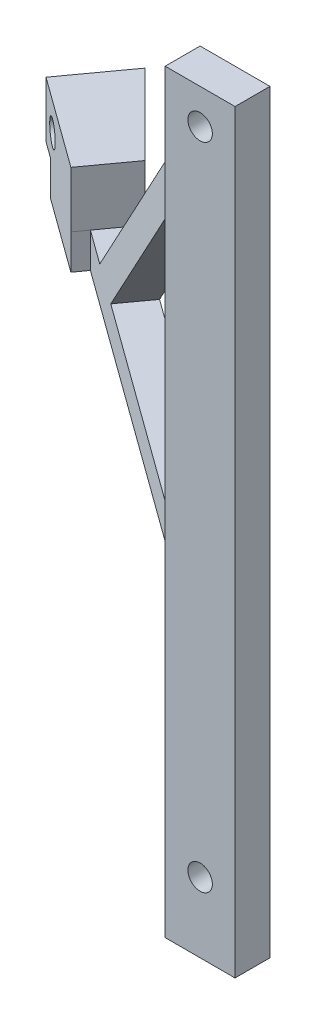
from build123d import *

# Parameters (mm, degrees)
SKETCH1_W           = 10
SKETCH1_H           = 108
BOSS_EXTRUDE1_DEPTH = 5
SKETCH2_R           = 1.75
CUT_EXTRUDE1_DEPTH  = 109.231233939
BOSS_EXTRUDE2_DEPTH = 5
SKETCH5_R           = 2.2
CUT_EXTRUDE2_DEPTH  = 5
BOSS_EXTRUDE3_REACH = 128.484
BOSS_EXTRUDE4_DEPTH = 8
SKETCH8_R           = 1.75
CUT_EXTRUDE3_DEPTH  = 129.116541509


with BuildPart() as part:
    # Sketch1 → Boss-Extrude1 (new body)
    with BuildSketch(Plane.XY):
        with Locations((0, 54)):
            Rectangle(SKETCH1_W, SKETCH1_H)
    extrude(amount=BOSS_EXTRUDE1_DEPTH)

    # Sketch2 → Cut-Extrude1 (cut, through all)
    with BuildSketch(Plane.XY.offset(5)):
        with Locations((0, 10)):
            Circle(SKETCH2_R)
        with Locations((0, 103)):
            Circle(SKETCH2_R)
    extrude(amount=-CUT_EXTRUDE1_DEPTH, mode=Mode.SUBTRACT)

    # Sketch4 → Boss-Extrude2 (add)
    with BuildSketch(Plane(origin=(0, 49.1, 0), x_dir=(-1, 0, 0), z_dir=(0, -1, 0))):
        Polygon((3.377813163, 0), (40.9972684, 27.282007374), (40.703728886, 27.686772187), (51.227614019, 35.318799552), (55.63070673, 29.247327359), (45.106791947, 21.615278492), (43.932633891, 23.234337744), (5, -5), align=None)
    extrude(amount=-BOSS_EXTRUDE2_DEPTH)

    # Sketch5 → Cut-Extrude2 (cut)
    with BuildSketch(Plane.XZ.offset(-49.1)):
        with Locations((-47.97, -29.25)):
            Circle(SKETCH5_R)
    extrude(amount=-CUT_EXTRUDE2_DEPTH, mode=Mode.SUBTRACT)

    # Boss-Extrude3: up to this face of the body (flat: up to its plane)
    boss_extrude3_end = Plane(part.part.faces().sort_by_distance((-22.187540781, 51.6, -13.641003687))[0])
    # Sketch6 → Boss-Extrude3 (add, up to the picked face)
    with BuildSketch(Plane(origin=(-4.099598255, 0, 5.652980403), x_dir=(0.8095296256563876, 0, 0.5870790280572362), z_dir=(-0.5870790280572362, 0, 0.8095296256563876)), mode=Mode.PRIVATE) as boss_extrude3_sk1:
        Polygon((-43.1833208, 54.1), (-1.112252988, 96.171067812), (-1.112252988, 89.1), (-36.112252988, 54.1), align=None)
    boss_extrude3_tool1 = split(extrude(boss_extrude3_sk1.sketch, amount=-BOSS_EXTRUDE3_REACH, mode=Mode.PRIVATE), bisect_by=boss_extrude3_end, keep=Keep.BOTH, mode=Mode.PRIVATE)
    add(boss_extrude3_tool1.solids().sort_by(Axis((-20.641593, 73.42183, -6.343441), (0.5870790280572362, 0, -0.8095296256563876)))[0])

    # Sketch7 → Boss-Extrude4 (add)
    with BuildSketch(Plane(origin=(0, 54.1, 0), x_dir=(1, 0, 0), z_dir=(0, 1, 0))):
        Polygon((-40.645020983, 27.767725149), (-52.102962866, 39.221816124), (-58.059295607, 31.008564443), (-45.106791947, 21.615278492), align=None)
    extrude(amount=BOSS_EXTRUDE4_DEPTH)

    # Sketch8 → Cut-Extrude3 (cut, through all)
    with BuildSketch(Plane(origin=(-6.431817345, 0, 6.433979746), x_dir=(-0.7072256172064263, 0, -0.7069879251917881), z_dir=(0.7069879251917881, 0, -0.7072256172064263))):
        with Locations((58.876646442, 58.1)):
            Circle(SKETCH8_R)
    extrude(amount=-CUT_EXTRUDE3_DEPTH, mode=Mode.SUBTRACT)


solid = part.part
